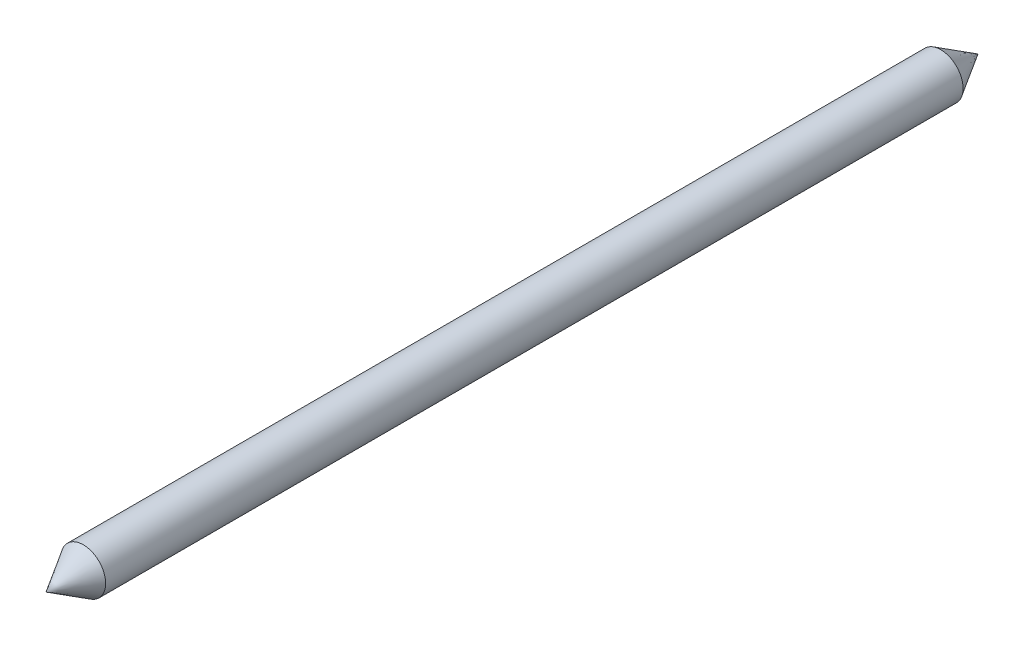
from build123d import *


with BuildPart() as part:
    # Sketch1 → Revolve1 (revolve)
    with BuildSketch(Plane(origin=(0, 0, 0), x_dir=(1, 0, 0), z_dir=(0, 1, 0)), mode=Mode.PRIVATE) as revolve1_sk:
        Polygon((7.62, 146.05), (7.62, -146.05), (0, -158.75), (0, 158.75), align=None)
    revolve(revolve1_sk.sketch.rotate(Axis((0, 0, -158.75), (0, 0, 1)), 180), axis=Axis((0, 0, -158.75), (0, 0, 1)))


solid = part.part
